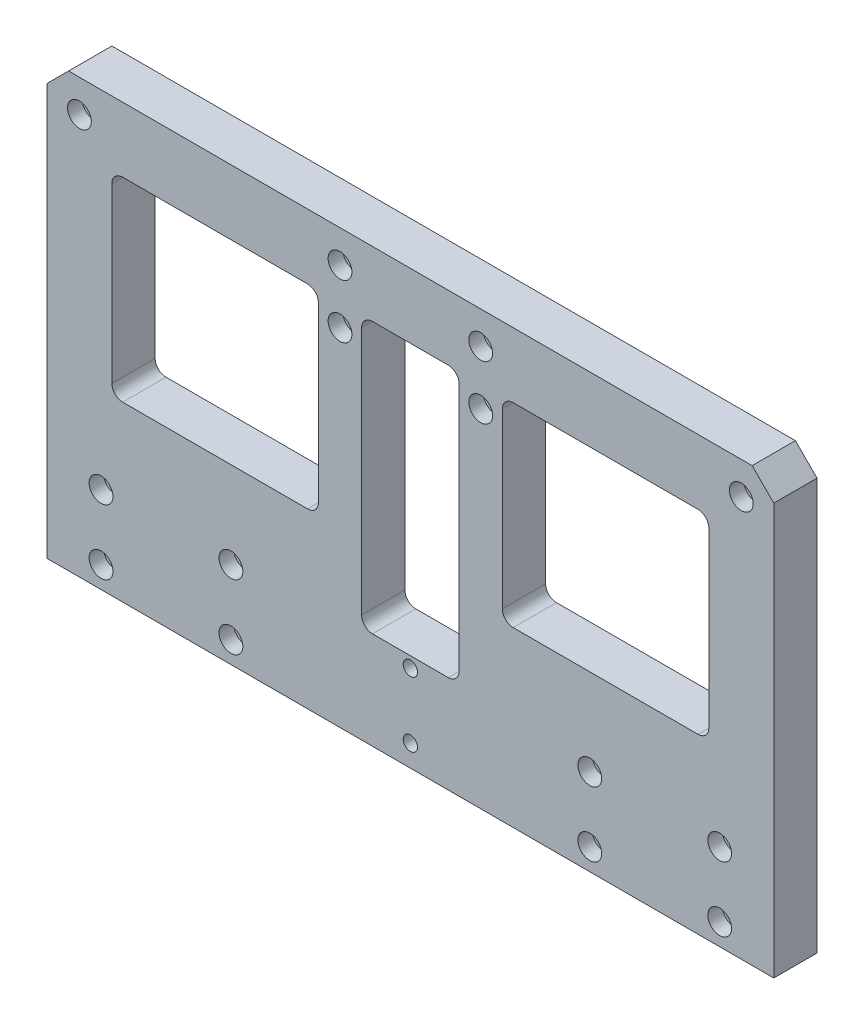
from build123d import *

# Parameters (mm, degrees)
SKETCH1_W                                            = 335.8
SKETCH1_H                                            = 200
BOSS_EXTRUDE1_DEPTH                                  = 20
SKETCH2_W                                            = 275.8
SKETCH2_H                                            = 90
CUT_EXTRUDE1_DEPTH                                   = 197.44441962
SKETCH3_W                                            = 45
SKETCH3_H                                            = 90
CUT_EXTRUDE2_DEPTH                                   = 197.44441962
CBORE_FOR_M6_HEXAGON_SOCKET_HEAD_CAP_SCR_D           = 6.6
CBORE_FOR_M6_HEXAGON_SOCKET_HEAD_CAP_SCR_CBORE_D     = 11
CBORE_FOR_M6_HEXAGON_SOCKET_HEAD_CAP_SCR_CBORE_DEPTH = 6.8
M6_CLEARANCE_HOLE1_D                                 = 6.6
SKETCH8_W                                            = 20
SKETCH8_H                                            = 90
BOSS_EXTRUDE2_DEPTH                                  = 20
FILLET1_R                                            = 5
CBORE_FOR_M6_HEXAGON_SOCKET_HEAD_CAP_2_D             = 6.6
CBORE_FOR_M6_HEXAGON_SOCKET_HEAD_CAP_2_CBORE_D       = 11
CBORE_FOR_M6_HEXAGON_SOCKET_HEAD_CAP_2_CBORE_DEPTH   = 6.8
CHAMFER1_SIZE                                        = 10


with BuildPart() as part:
    # Sketch1 → Boss-Extrude1 (new body)
    with BuildSketch(Plane.XY):
        Rectangle(SKETCH1_W, SKETCH1_H)
    extrude(amount=BOSS_EXTRUDE1_DEPTH)

    # Sketch2 → Cut-Extrude1 (cut, through all)
    with BuildSketch(Plane.XY.offset(20)):
        with Locations((0, 25)):
            Rectangle(SKETCH2_W, SKETCH2_H)
    extrude(amount=-CUT_EXTRUDE1_DEPTH, mode=Mode.SUBTRACT)

    # Sketch3 → Cut-Extrude2 (cut, through all)
    with BuildSketch(Plane(origin=(0, 0, 0), x_dir=(-1, 0, 0), z_dir=(0, 0, -1))):
        with Locations((0, -10)):
            Rectangle(SKETCH3_W, SKETCH3_H)
    extrude(amount=-CUT_EXTRUDE2_DEPTH, mode=Mode.SUBTRACT)

    # CBORE for M6 Hexagon socket head cap scr (through all)
    with Locations(Plane.XY.offset(20)):
        with Locations((-142.9, -60), (-142.9, -90), (-82.9, -60), (-82.9, -90), (82.9, -90), (82.9, -60), (142.9, -90), (142.9, -60)):
            CounterBoreHole(CBORE_FOR_M6_HEXAGON_SOCKET_HEAD_CAP_SCR_D / 2, CBORE_FOR_M6_HEXAGON_SOCKET_HEAD_CAP_SCR_CBORE_D / 2, CBORE_FOR_M6_HEXAGON_SOCKET_HEAD_CAP_SCR_CBORE_DEPTH)

    # M6 Clearance Hole1 (through all)
    with Locations(Plane.XY.offset(20)):
        with Locations((0, -60), (0, -90)):
            Hole(M6_CLEARANCE_HOLE1_D / 2)

    # Sketch8 → Boss-Extrude2 (add)
    with BuildSketch(Plane.XY.offset(20)):
        with Locations((-32.5, 25)):
            Rectangle(SKETCH8_W, SKETCH8_H)
        with Locations((32.5, 25)):
            Rectangle(SKETCH8_W, SKETCH8_H)
    extrude(amount=-BOSS_EXTRUDE2_DEPTH)

    # Fillet1
    fillet1_edges = [part.edges().sort_by_distance(p)[0] for p in [
        (-22.5, 70, 10),
        (-42.5, -20, 10),
        (-42.5, 70, 10),
        (22.5, 70, 10),
        (42.5, 70, 10),
        (42.5, -20, 10),
        (-137.9, -20, 10),
        (-137.9, 70, 10),
        (137.9, 70, 10),
        (137.9, -20, 10),
        (22.5, -55, 10),
        (-22.5, -55, 10),
    ]]
    fillet(fillet1_edges, radius=FILLET1_R)

    # CBORE for M6 Hexagon socket head cap 2 (through all)
    with Locations(Plane.XY.offset(20)):
        with Locations((-152.9, 85), (-32.5, 60), (-32.5, 85), (32.5, 85), (32.5, 60), (152.9, 85)):
            CounterBoreHole(CBORE_FOR_M6_HEXAGON_SOCKET_HEAD_CAP_2_D / 2, CBORE_FOR_M6_HEXAGON_SOCKET_HEAD_CAP_2_CBORE_D / 2, CBORE_FOR_M6_HEXAGON_SOCKET_HEAD_CAP_2_CBORE_DEPTH)

    # Chamfer1
    chamfer1_edges = [part.edges().sort_by_distance(p)[0] for p in [
        (167.9, 100, 10),
        (-167.9, 100, 10),
    ]]
    chamfer(chamfer1_edges, length=CHAMFER1_SIZE)


solid = part.part
